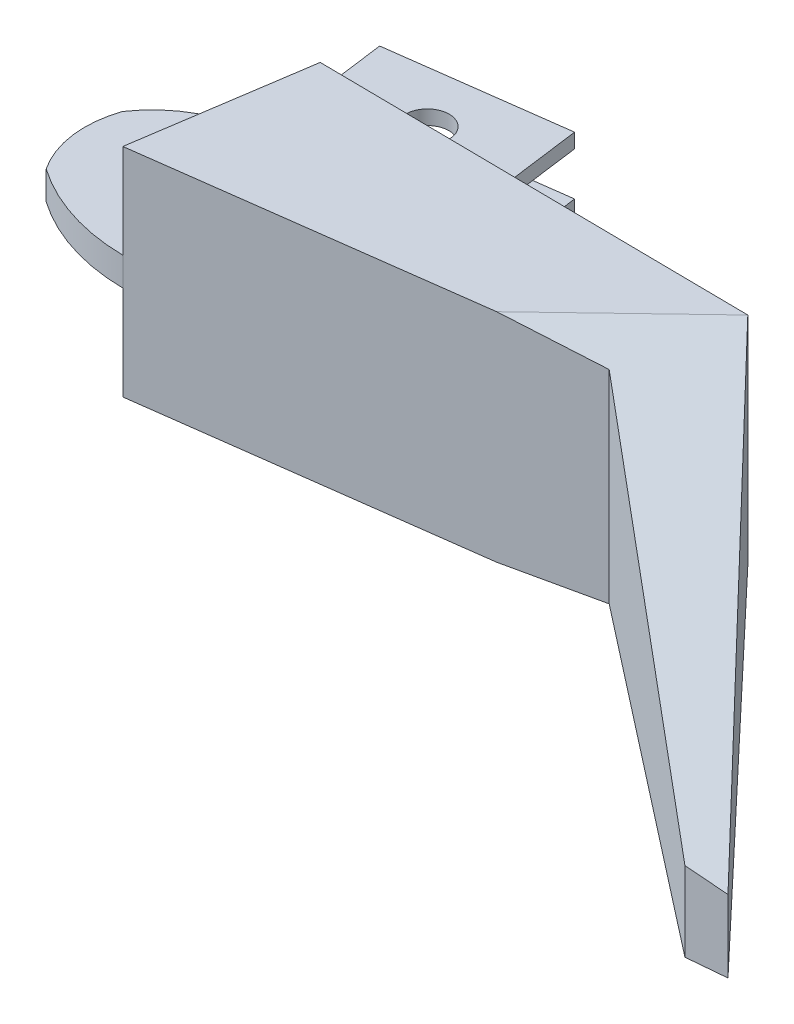
from build123d import *

# Parameters (mm, degrees)
EXTRUDE_1_DEPTH      = 150
SKETCH_3_W           = 134.939871442
SKETCH_3_H           = 65.077722632
SKETCH_3_W_2         = 12.852713976
SKETCH_3_H_2         = 65.21229221
SKETCH_3_W_3         = 22.325721816
CUT_EXTRUDE_5_DEPTH  = 100
SKETCH_4_R           = 10
CUT_EXTRUDE_6_DEPTH  = 100
CUT_EXTRUDE_7_DEPTH  = 542.338297497
SKETCH_9_W           = 120
SKETCH_9_H           = 50
EXTRUDE_5_DEPTH      = 200
SKETCH_12_W          = 124.1848091
SKETCH_12_H          = 30
CUT_EXTRUDE_14_DEPTH = 60
SKETCH_13_R          = 15
CUT_EXTRUDE_15_DEPTH = 459.970793946
CUT_EXTRUDE_16_DEPTH = 600
CUT_EXTRUDE_18_DEPTH = 600
CUT_EXTRUDE_23_DEPTH = 600


with BuildPart() as part:
    # 草图1 → 凸台-拉伸1 (new body)
    with BuildSketch(Plane(origin=(0, 0, 0), x_dir=(1, 0, 0), z_dir=(0, 1, 0))):
        Polygon((-296.625222025, 119.18294849), (103.374777975, 114.564831261), (393.424758435, -189.19660282), (363.661240814, -189.19660282), (83.221819158, 38.873627041), (-316.778180842, -14.24353747), align=None)
    extrude(amount=EXTRUDE_1_DEPTH)

    # 草图3 → 切除-拉伸5 (cut)
    with BuildSketch(Plane(origin=(-307.609145788, 0, -46.461798062), x_dir=(-0.14934769539615667, 0, 0.9887847419331757), z_dir=(-0.9887847419331757, 0, -0.14934769539615664))):
        Polygon((-73.54598766, 84.922277368), (-73.54598766, 150), (-110.299587537, 150), (-108.970561803, 84.922277368), align=None)
        with Locations((-6.076051939, 117.461138684)):
            Rectangle(SKETCH_3_W, SKETCH_3_H)
        with Locations((67.82024077, 117.461138684)):
            Rectangle(SKETCH_3_W_2, SKETCH_3_H)
        Polygon((-73.54598766, 0), (-73.54598766, 65.21229221), (-88.627784697, 65.21229221), (-110.299587537, 65.21229221), (-110.299587537, 0), align=None)
        with Locations((-6.076051939, 32.606146105)):
            Rectangle(SKETCH_3_W, SKETCH_3_H_2)
        with Locations((72.55674469, 32.606146105)):
            Rectangle(SKETCH_3_W_3, SKETCH_3_H_2)
    extrude(amount=-CUT_EXTRUDE_5_DEPTH, mode=Mode.SUBTRACT)

    # 草图4 → 切除-拉伸6 (cut)
    with BuildSketch(Plane(origin=(0, 84.922277368, 0), x_dir=(1, 0, 0), z_dir=(0, 1, 0))):
        with Locations(Location((-255.193452216, 58.700607885, 0), (0, 0, 270))):
            Circle(SKETCH_4_R)
    extrude(amount=-CUT_EXTRUDE_6_DEPTH, mode=Mode.SUBTRACT)

    # 草图5 → 切除-拉伸7 (cut, through all)
    with BuildSketch(Plane(origin=(111.294466259, 0, -106.270757713), x_dir=(-0.6905951915709648, 0, -0.7232415097179243), z_dir=(0.7232415097179243, 0, -0.6905951915709648))):
        Polygon((11.467916923, 150), (-408.532083077, 100), (-408.532083077, 150), align=None)
        Polygon((11.467916923, 0), (-408.532083077, 50), (-408.532083077, 0), align=None)
    extrude(amount=-CUT_EXTRUDE_7_DEPTH, mode=Mode.SUBTRACT)

    # 草图9 → 凸台-拉伸5 (add)
    with BuildSketch(Plane(origin=(-3.630590426, 0, -27.340242721), x_dir=(0.9912979424923631, 0, -0.13163733972702288), z_dir=(0.13163733972702288, 0, 0.9912979424923631))):
        with Locations((-146.786325955, 75)):
            Rectangle(SKETCH_9_W, SKETCH_9_H)
    extrude(amount=-EXTRUDE_5_DEPTH)

    # 草图12 → 切除-拉伸14 (cut)
    with BuildSketch(Plane(origin=(-29.958058371, 0, -225.599831219), x_dir=(-0.991297942492363, 0, 0.1316373397270229), z_dir=(-0.1316373397270229, 0, -0.991297942492363))):
        with Locations((145.743983676, 75)):
            Rectangle(SKETCH_12_W, SKETCH_12_H)
    extrude(amount=-CUT_EXTRUDE_14_DEPTH, mode=Mode.SUBTRACT)

    # 草图13 → 切除-拉伸15 (cut, through all)
    with BuildSketch(Plane(origin=(0, 50, 0), x_dir=(-1, 0, 0), z_dir=(0, -1, 0))):
        with Locations(Location((170.201547688, 166.625352062, 0), (0, 0, 270))):
            Circle(SKETCH_13_R)
    extrude(amount=-CUT_EXTRUDE_15_DEPTH, mode=Mode.SUBTRACT)

    # 草图14 → 切除-拉伸16 (cut)
    with BuildSketch(Plane.XZ.offset(-65.21229221)):
        with BuildLine():
            Line((-316.778180842, 14.24353747), (-213.573939594, 0.538745819))
            ThreePointArc((-213.573939594, 0.538745819), (-264.946374334, -9.940662831), (-308.780384447, -38.707390387))
            Line((-308.780384447, -38.707390387), (-316.778180842, 14.24353747))
        make_face()
    extrude(amount=-CUT_EXTRUDE_16_DEPTH, mode=Mode.SUBTRACT)

    # 草图15 → 切除-拉伸18 (cut)
    with BuildSketch(Plane(origin=(0, 65.21229221, 0), x_dir=(-1, 0, 0), z_dir=(0, -1, 0))):
        with BuildLine():
            ThreePointArc((245.824298176, 118.596436936), (278.450621549, 106.430151008), (302.373134739, 81.127802248))
            Line((302.373134739, 81.127802248), (296.625222025, 119.18294849))
            Line((296.625222025, 119.18294849), (245.824298176, 118.596436936))
        make_face()
    extrude(amount=-CUT_EXTRUDE_18_DEPTH, mode=Mode.SUBTRACT)

    # 草图16 → 切除-拉伸23 (cut)
    with BuildSketch(Plane(origin=(0, 65.21229221, 0), x_dir=(-1, 0, 0), z_dir=(0, -1, 0))):
        with BuildLine():
            Line((291.65867542, 24.560550225), (320.979664595, 36.581658237))
            Line((320.979664595, 36.581658237), (321.34512954, 76.765505909))
            Line((321.34512954, 76.765505909), (299.707915755, 85.363339544))
            ThreePointArc((299.707915755, 85.363339544), (302.777897257, 54.022742019), (291.65867542, 24.560550225))
        make_face()
    extrude(amount=-CUT_EXTRUDE_23_DEPTH, mode=Mode.SUBTRACT)


solid = part.part
